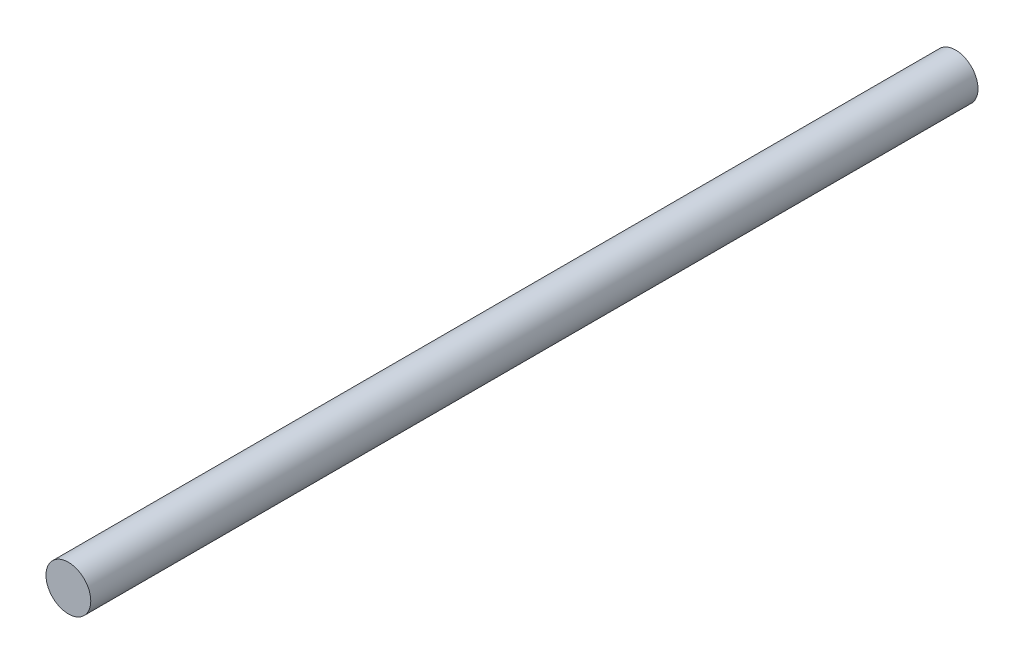
from build123d import *

# Parameters (mm, degrees)
SKETCH1_R           = 1.778
BOSS_EXTRUDE1_DEPTH = 70.3804719


with BuildPart() as part:
    # Sketch1 → Boss-Extrude1 (new body)
    with BuildSketch(Plane.XY):
        Circle(SKETCH1_R)
    extrude(amount=-BOSS_EXTRUDE1_DEPTH)


solid = part.part
